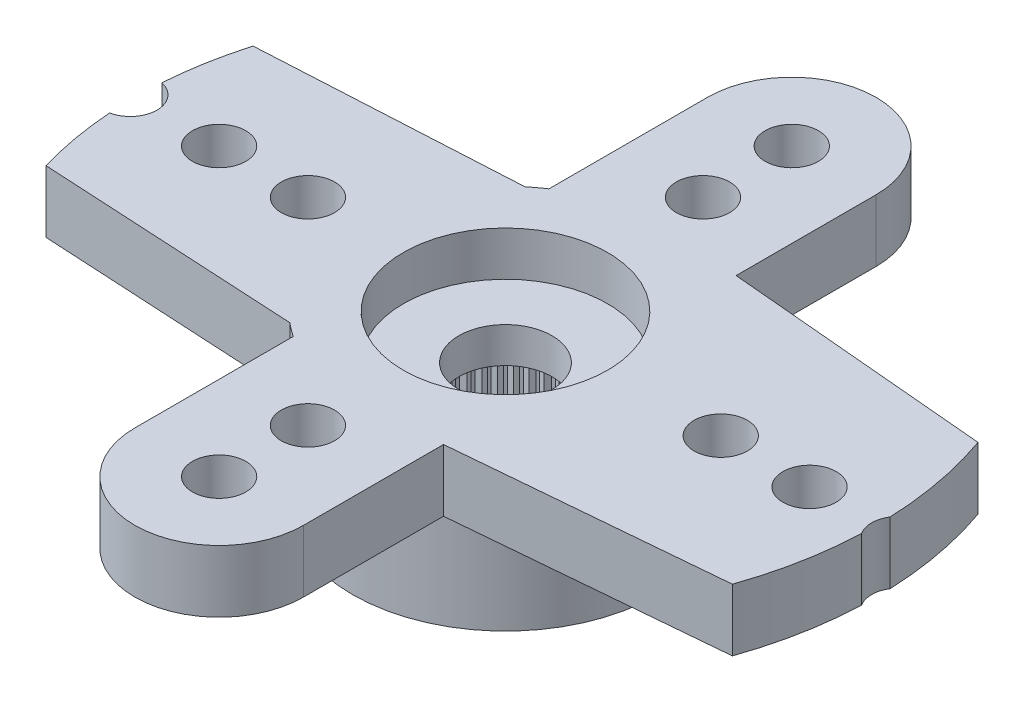
from build123d import *

# Parameters (mm, degrees)
RESSALTO_EXTRUS_O1_DEPTH = 1.4
ESBO_O2_R                = 3.45
RESSALTO_EXTRUS_O2_DEPTH = 2.4
FURO1_D                  = 1.2
PADR_O_LINEAR1_COUNT     = 6
PADR_O_LINEAR1_PITCH     = 2
RESSALTO_EXTRUS_O3_DEPTH = 1.4
FURO2_D                  = 1.2
PADR_O_LINEAR2_COUNT     = 7
PADR_O_LINEAR2_PITCH     = 2
RESSALTO_EXTRUS_O4_DEPTH = 1.4
FURO3_D                  = 1.2
PADR_O_LINEAR3_COUNT     = 2
PADR_O_LINEAR3_PITCH     = 2
PADR_OCIRCULAR1_COUNT    = 2
PADR_OCIRCULAR1_COPY_1_D = 1.2
FURO4_D                  = 4.95
FURO4_DEPTH              = 2
FURO5_D                  = 4.6
FURO5_DEPTH              = 1
FURO6_D                  = 2.1
RESSALTO_EXTRUS_O5_START = -2
RESSALTO_EXTRUS_O5_DEPTH = 2
PADR_OCIRCULAR2_COUNT    = 60
SKETCH1_R                = 18.45
SKETCH1_R_2              = 8.35
CUT_EXTRUDE1_DEPTH       = 10


with BuildPart() as part:
    # Esboço1 → Ressalto-extrusão1 (new body)
    with BuildSketch(Plane(origin=(0, 0, 0), x_dir=(1, 0, 0), z_dir=(0, 1, 0))):
        with BuildLine():
            Line((-14.159121967, 1.99702088), (-2.209072203, 2.65))
            ThreePointArc((-2.209072203, 2.65), (3.45, 0), (-2.209072203, -2.65))
            Line((-2.209072203, -2.65), (-14.159121967, -1.99702088))
            ThreePointArc((-14.159121967, -1.99702088), (-16.05, 0), (-14.159121967, 1.99702088))
        make_face()
    extrude(amount=-RESSALTO_EXTRUS_O1_DEPTH)

    # Esboço2 → Ressalto-extrusão2 (add)
    with BuildSketch(Plane.XZ.offset(1.4)):
        with Locations(Location((0, 0, 0), (0, 0, 90))):
            Circle(ESBO_O2_R)
    extrude(amount=RESSALTO_EXTRUS_O2_DEPTH)

    # Furo1 (through all)
    with Locations(Plane(origin=(0, 0, 0), x_dir=(1, 0, 0), z_dir=(0, 1, 0))):
        with Locations((-14.45, 0)):
            furo1 = Hole(FURO1_D / 2)

    # Padrão linear1: Furo1 ×6
    with Locations(*[(i * PADR_O_LINEAR1_PITCH, 0, 0) for i in range(1, PADR_O_LINEAR1_COUNT)]):
        add(furo1, mode=Mode.SUBTRACT)

    # Esboço12 → Ressalto-extrusão3 (add)
    with BuildSketch(Plane(origin=(0, 0, 0), x_dir=(1, 0, 0), z_dir=(0, 1, 0))):
        with BuildLine():
            Line((0.304103343, 3.436571134), (16.626291793, 1.99221515))
            ThreePointArc((16.626291793, 1.99221515), (18.45, 0), (16.626291793, -1.99221515))
            Line((16.626291793, -1.99221515), (0.304103343, -3.436571134))
            ThreePointArc((0.304103343, -3.436571134), (3.45, 0), (0.304103343, 3.436571134))
        make_face()
    extrude(amount=-RESSALTO_EXTRUS_O3_DEPTH)

    # Furo2 (through all)
    with Locations(Plane(origin=(0, 0, 0), x_dir=(1, 0, 0), z_dir=(0, 1, 0))):
        with Locations((16.85, 0)):
            furo2 = Hole(FURO2_D / 2)

    # Padrão linear2: Furo2 ×7
    with Locations(*[(-i * PADR_O_LINEAR2_PITCH, 0, 0) for i in range(1, PADR_O_LINEAR2_COUNT)]):
        add(furo2, mode=Mode.SUBTRACT)

    # Esboço16 → Ressalto-extrusão4 (add)
    with BuildSketch(Plane(origin=(0, 0, 0), x_dir=(1, 0, 0), z_dir=(0, 1, 0))):
        with BuildLine():
            Line((-1.9, -6.45), (-1.9, 6.45))
            ThreePointArc((-1.9, 6.45), (0, 8.35), (1.9, 6.45))
            Line((1.9, 6.45), (1.9, -6.45))
            ThreePointArc((1.9, -6.45), (0, -8.35), (-1.9, -6.45))
        make_face()
    extrude(amount=-RESSALTO_EXTRUS_O4_DEPTH)

    # Furo3 (through all)
    with Locations(Plane(origin=(0, 0, 0), x_dir=(1, 0, 0), z_dir=(0, 1, 0))):
        with Locations((0, -6.45)):
            furo3 = Hole(FURO3_D / 2)

    # Padrão linear3: Furo3 ×2
    with Locations(*[(0, 0, -i * PADR_O_LINEAR3_PITCH) for i in range(1, PADR_O_LINEAR3_COUNT)]):
        add(furo3, mode=Mode.SUBTRACT)

    # PadrãoCircular1: Furo3 ×2 about axis
    padr_ocircular1_axis = Axis((0, 0, 0), (0, 1, 0))
    for i in range(1, PADR_OCIRCULAR1_COUNT):
        add(furo3.rotate(padr_ocircular1_axis, i * 360 / PADR_OCIRCULAR1_COUNT), mode=Mode.SUBTRACT)

    # PadrãoCircular1 copy 1 (through all)
    with Locations(Plane(origin=(0, 0, 2), x_dir=(-1, 0, 0), z_dir=(0, 1, 0))):
        with Locations((0, -6.45)):
            Hole(PADR_OCIRCULAR1_COPY_1_D / 2)

    # Furo4
    with Locations(Plane(origin=(0, -3.8, 0), x_dir=(-1, 0, 0), z_dir=(0, -1, 0))):
        with Locations((0, 0)):
            Hole(FURO4_D / 2, depth=FURO4_DEPTH)

    # Furo5
    with Locations(Plane(origin=(0, 0, 0), x_dir=(1, 0, 0), z_dir=(0, 1, 0))):
        with Locations((0, 0)):
            Hole(FURO5_D / 2, depth=FURO5_DEPTH)

    # Furo6 (through all)
    with Locations(Plane(origin=(0, 0, 0), x_dir=(1, 0, 0), z_dir=(0, 1, 0))):
        with Locations((0, 0)):
            Hole(FURO6_D / 2)

    # Esboço11 → Ressalto-extrusão5 (add)
    with BuildSketch(Plane.XZ.offset(3.8).offset(RESSALTO_EXTRUS_O5_START)):
        with BuildLine():
            Line((-0.098056786, 2.473056786), (0, 2.375))
            Line((0, 2.375), (0.098056786, 2.473056786))
            ThreePointArc((0.098056786, 2.473056786), (0, 2.475), (-0.098056786, 2.473056786))
        make_face()
    ressalto_extrus_o5 = extrude(amount=RESSALTO_EXTRUS_O5_DEPTH)

    # PadrãoCircular2: Ressalto-extrusão5 ×60 about axis
    padr_ocircular2_axis = Axis((0, 0, 0), (0, 1, 0))
    for i in range(1, PADR_OCIRCULAR2_COUNT):
        add(ressalto_extrus_o5.rotate(padr_ocircular2_axis, i * 360 / PADR_OCIRCULAR2_COUNT))

    # Sketch1 → Cut-Extrude1 (cut)
    with BuildSketch(Plane(origin=(0, 0, 0), x_dir=(1, 0, 0), z_dir=(0, 1, 0))):
        Circle(SKETCH1_R)
        Circle(SKETCH1_R_2, mode=Mode.SUBTRACT)
    extrude(amount=-CUT_EXTRUDE1_DEPTH, mode=Mode.SUBTRACT)


solid = part.part
